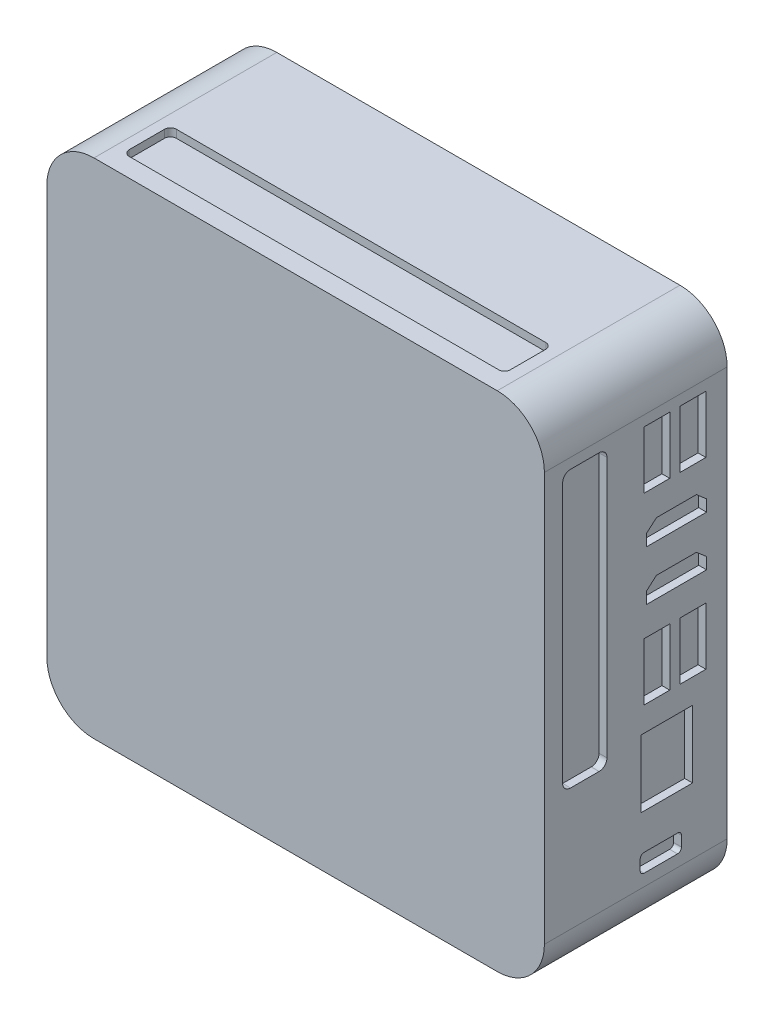
from build123d import *

# Parameters (mm, degrees)
DODANIE_WYCI_GNI_CIE1_DEPTH = 46.5
WYTNIJ_WYCI_GNI_CIE1_DEPTH  = 2
SZKIC3_R                    = 3.25
WYTNIJ_WYCI_GNI_CIE2_DEPTH  = 2
DODANIE_WYCI_GNI_CIE2_DEPTH = 2
SZKIC5_W                    = 6.61
SZKIC5_H                    = 14.6
SZKIC5_W_2                  = 13.12
SZKIC5_H_2                  = 17.13
WYTNIJ_WYCI_GNI_CIE3_DEPTH  = 2
SKETCH1_R                   = 2
CUT_EXTRUDE1_DEPTH          = 5


with BuildPart() as part:
    # Szkic1 → Dodanie-wyciągnięcie1 (new body)
    with BuildSketch(Plane.XY):
        with BuildLine():
            Line((-51.3, -64), (51.3, -64))
            ThreePointArc((51.3, -64), (59.785281374, -60.485281374), (63.3, -52))
            Line((63.3, -52), (63.3, 52))
            ThreePointArc((63.3, 52), (59.785281374, 60.485281374), (51.3, 64))
            Line((51.3, 64), (-51.3, 64))
            ThreePointArc((-51.3, 64), (-59.785281374, 60.485281374), (-63.3, 52))
            Line((-63.3, 52), (-63.3, -52))
            ThreePointArc((-63.3, -52), (-59.785281374, -60.485281374), (-51.3, -64))
        make_face()
    extrude(amount=DODANIE_WYCI_GNI_CIE1_DEPTH)

    # Szkic2 → Wytnij-wyciągnięcie1 (cut)
    with BuildSketch(Plane(origin=(0, 64, 0), x_dir=(1, 0, 0), z_dir=(0, 1, 0))):
        with BuildLine():
            Line((-48.65, -31.2), (-48.65, -40.2))
            ThreePointArc((-48.65, -40.2), (-48.210660172, -41.260660172), (-47.15, -41.7))
            Line((-47.15, -41.7), (46.85, -41.7))
            ThreePointArc((46.85, -41.7), (47.910660172, -41.260660172), (48.35, -40.2))
            Line((48.35, -40.2), (48.35, -31.2))
            ThreePointArc((48.35, -31.2), (47.910660172, -30.139339828), (46.85, -29.7))
            Line((46.85, -29.7), (-47.15, -29.7))
            ThreePointArc((-47.15, -29.7), (-48.210660172, -30.139339828), (-48.65, -31.2))
        make_face()
    wytnij_wyci_gni_cie1 = extrude(amount=-WYTNIJ_WYCI_GNI_CIE1_DEPTH, mode=Mode.SUBTRACT)

    # Szkic3 → Wytnij-wyciągnięcie2 (cut)
    with BuildSketch(Plane.ZY.offset(63.3)):
        with BuildLine():
            ThreePointArc((28, -44.3), (28.439339828, -45.360660172), (29.5, -45.8))
            Line((29.5, -45.8), (38.5, -45.8))
            ThreePointArc((38.5, -45.8), (39.560660172, -45.360660172), (40, -44.3))
            Line((40, -44.3), (40, 43.7))
            ThreePointArc((40, 43.7), (39.560660172, 44.760660172), (38.5, 45.2))
            Line((38.5, 45.2), (29.5, 45.2))
            ThreePointArc((29.5, 45.2), (28.439339828, 44.760660172), (28, 43.7))
            Line((28, 43.7), (28, -44.3))
        make_face()
        with BuildLine():
            Line((17.02769909, -28.8), (17.02769909, -23))
            ThreePointArc((17.02769909, -23), (15.37769909, -21.35), (13.72769909, -23))
            Line((13.72769909, -23), (13.72769909, -28.8))
            ThreePointArc((13.72769909, -28.8), (15.37769909, -30.45), (17.02769909, -28.8))
        make_face()
        with BuildLine():
            Line((17.02769909, -9.7), (17.02769909, -3.9))
            ThreePointArc((17.02769909, -3.9), (15.37769909, -2.25), (13.72769909, -3.9))
            Line((13.72769909, -3.9), (13.72769909, -9.7))
            ThreePointArc((13.72769909, -9.7), (15.37769909, -11.35), (17.02769909, -9.7))
        make_face()
        with Locations((15.37769909, 10.1)):
            Circle(SZKIC3_R)
    extrude(amount=-WYTNIJ_WYCI_GNI_CIE2_DEPTH, mode=Mode.SUBTRACT)

    # Szkic3<3> → Dodanie-wyciągnięcie2 (add)
    with BuildSketch(Plane.ZY.offset(63.3)):
        with BuildLine():
            Line((17.37769909, 32.6), (13.37769909, 32.6))
            ThreePointArc((13.37769909, 32.6), (12.670592309, 32.307106781), (12.37769909, 31.6))
            Line((12.37769909, 31.6), (12.37769909, 23.1))
            ThreePointArc((12.37769909, 23.1), (12.670592309, 22.392893219), (13.37769909, 22.1))
            Line((13.37769909, 22.1), (17.37769909, 22.1))
            ThreePointArc((17.37769909, 22.1), (18.084805871, 22.392893219), (18.37769909, 23.1))
            Line((18.37769909, 23.1), (18.37769909, 31.6))
            ThreePointArc((18.37769909, 31.6), (18.084805871, 32.307106781), (17.37769909, 32.6))
        make_face()
    extrude(amount=DODANIE_WYCI_GNI_CIE2_DEPTH)

    # Lustro1: Wytnij-wyciągnięcie1 across plane
    add(wytnij_wyci_gni_cie1.mirror(Plane.ZX), mode=Mode.SUBTRACT)

    # Szkic5 → Wytnij-wyciągnięcie3 (cut)
    with BuildSketch(Plane(origin=(63.3, 0, 0), x_dir=(0, 0, -1), z_dir=(1, 0, 0))):
        with BuildLine():
            Line((-39.86, 49.36), (-32.58, 49.36))
            ThreePointArc((-32.58, 49.36), (-31.165786438, 48.774213562), (-30.58, 47.36))
            Line((-30.58, 47.36), (-30.58, -18.86))
            ThreePointArc((-30.58, -18.86), (-31.165786438, -20.274213562), (-32.58, -20.86))
            Line((-32.58, -20.86), (-39.86, -20.86))
            ThreePointArc((-39.86, -20.86), (-41.274213562, -20.274213562), (-41.86, -18.86))
            Line((-41.86, -18.86), (-41.86, 47.36))
            ThreePointArc((-41.86, 47.36), (-41.274213562, 48.774213562), (-39.86, 49.36))
        make_face()
        with BuildLine():
            Line((-21.12, -44.41), (-12.62, -44.41))
            ThreePointArc((-12.62, -44.41), (-11.912893219, -44.702893219), (-11.62, -45.41))
            Line((-11.62, -45.41), (-11.62, -48))
            ThreePointArc((-11.62, -48), (-11.912893219, -48.707106781), (-12.62, -49))
            Line((-12.62, -49), (-21.12, -49))
            ThreePointArc((-21.12, -49), (-21.827106781, -48.707106781), (-22.12, -48))
            Line((-22.12, -48), (-22.12, -45.41))
            ThreePointArc((-22.12, -45.41), (-21.827106781, -44.702893219), (-21.12, -44.41))
        make_face()
        with Locations((-8.705, -4.63)):
            Rectangle(SZKIC5_W, SZKIC5_H)
        with Locations((-15.36, -26.725)):
            Rectangle(SZKIC5_W_2, SZKIC5_H_2)
        with Locations((-17.905, -4.63)):
            Rectangle(SZKIC5_W, SZKIC5_H)
        Polygon((-20.57, 9.9), (-5.24, 9.9), (-5.24, 12.83), (-7.82, 15.06), (-17.99, 15.06), (-20.57, 12.83), align=None)
        Polygon((-7.82, 27.77), (-5.24, 25.54), (-5.24, 22.61), (-20.57, 22.61), (-20.57, 25.54), (-17.99, 27.77), align=None)
        with Locations((-17.905, 42.04)):
            Rectangle(SZKIC5_W, SZKIC5_H)
        with Locations((-8.705, 42.04)):
            Rectangle(SZKIC5_W, SZKIC5_H)
    extrude(amount=-WYTNIJ_WYCI_GNI_CIE3_DEPTH, mode=Mode.SUBTRACT)

    # Sketch1 → Cut-Extrude1 (cut)
    with BuildSketch(Plane(origin=(0, 0, 0), x_dir=(-1, 0, 0), z_dir=(0, 0, -1))):
        with Locations((-43, 0)):
            Circle(SKETCH1_R)
        with Locations((43, 0)):
            Circle(SKETCH1_R)
    extrude(amount=-CUT_EXTRUDE1_DEPTH, mode=Mode.SUBTRACT)


solid = part.part
